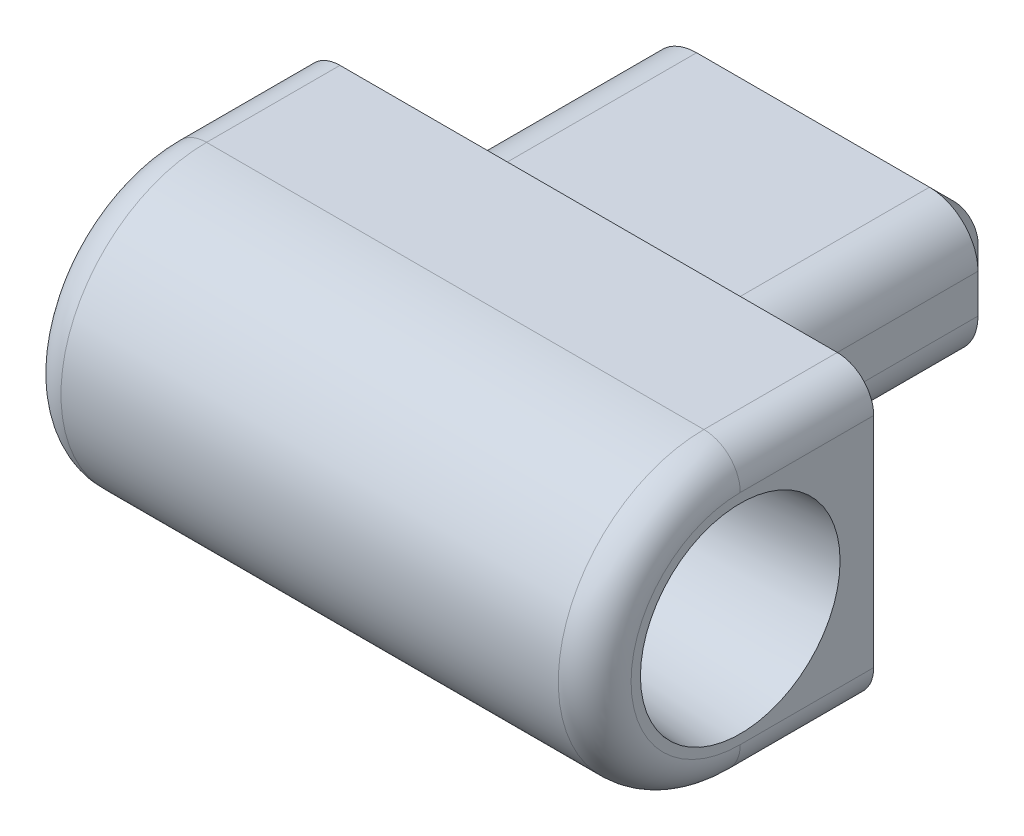
from build123d import *

# Parameters (mm, degrees)
BODY_START                       = 1.25
BODY_DEPTH                       = 11.75
PEG_DEPTH                        = 6
CHAMFER1_SIZE                    = 0.5
M2_5_CLEARANCE_HOLE1_D           = 2.7
M2_5_CLEARANCE_HOLE1_CSINK_D     = 2.75
M2_5_CLEARANCE_HOLE1_CSINK_ANGLE = 90
FILLET3_R                        = 0.75


with BuildPart() as part:
    # Sketch2 → body (new body)
    with BuildSketch(Plane.ZY.offset(29.5).offset(BODY_START)):
        with BuildLine():
            Line((2.75, -3), (0, -3))
            Line((0, -3), (0, 3))
            Line((0, 3), (2.75, 3))
            ThreePointArc((2.75, 3), (5.75, 0), (2.75, -3))
        make_face()
    extrude(amount=BODY_DEPTH)

    # Sketch3 → peg (add)
    with BuildSketch(Plane(origin=(0, 0, 0), x_dir=(-1, 0, 0), z_dir=(0, 0, -1))):
        with BuildLine():
            Line((35.1, 1.4), (39.9, 1.4))
            ThreePointArc((39.9, 1.4), (40.607106781, 1.107106781), (40.9, 0.4))
            Line((40.9, 0.4), (40.9, -0.4))
            ThreePointArc((40.9, -0.4), (40.607106781, -1.107106781), (39.9, -1.4))
            Line((39.9, -1.4), (35.1, -1.4))
            ThreePointArc((35.1, -1.4), (34.392893219, -1.107106781), (34.1, -0.4))
            Line((34.1, -0.4), (34.1, 0.4))
            ThreePointArc((34.1, 0.4), (34.392893219, 1.107106781), (35.1, 1.4))
        make_face()
    extrude(amount=PEG_DEPTH)

    # Chamfer1
    chamfer1_edges = [part.edges().sort_by_distance(p)[0] for p in [
        (-34.392893219, 1.107106781, -6),
        (-34.1, 0, -6),
        (-34.392893219, -1.107106781, -6),
        (-37.5, -1.4, -6),
        (-40.607106781, -1.107106781, -6),
        (-40.9, 0, -6),
        (-40.607106781, 1.107106781, -6),
        (-37.5, 1.4, -6),
    ]]
    chamfer(chamfer1_edges, length=CHAMFER1_SIZE)

    # Sketch5 → 9/64 (0.14063) Diameter Hole1 (revolve, cut)
    with BuildSketch(Plane(origin=(-30.75, 0, 2.75), x_dir=(0, 0, -1), z_dir=(0, 1, 0))):
        Polygon((0, 0), (0, 8.073137666), (1.786001, 7), (1.786001, 3.881186521), (2.0574, 0), align=None)
    revolve(axis=Axis((-24.4, 0, 2.75), (-1, 0, 0)), mode=Mode.SUBTRACT)

    # M2.5 Clearance Hole1 (through all)
    with Locations(Plane.ZY.offset(42.5)):
        with Locations((2.75, 0)):
            CounterSinkHole(M2_5_CLEARANCE_HOLE1_D / 2, M2_5_CLEARANCE_HOLE1_CSINK_D / 2, counter_sink_angle=M2_5_CLEARANCE_HOLE1_CSINK_ANGLE)

    # Fillet3
    fillet3_edges = [part.edges().sort_by_distance(p)[0] for p in [
        (-42.5, -3, 1.375),
        (-42.5, 0, 5.75),
        (-30.75, -3, 1.375),
        (-30.75, 3, 1.375),
        (-30.75, 0, 5.75),
        (-42.5, 3, 1.375),
    ]]
    fillet(fillet3_edges, radius=FILLET3_R)


solid = part.part
